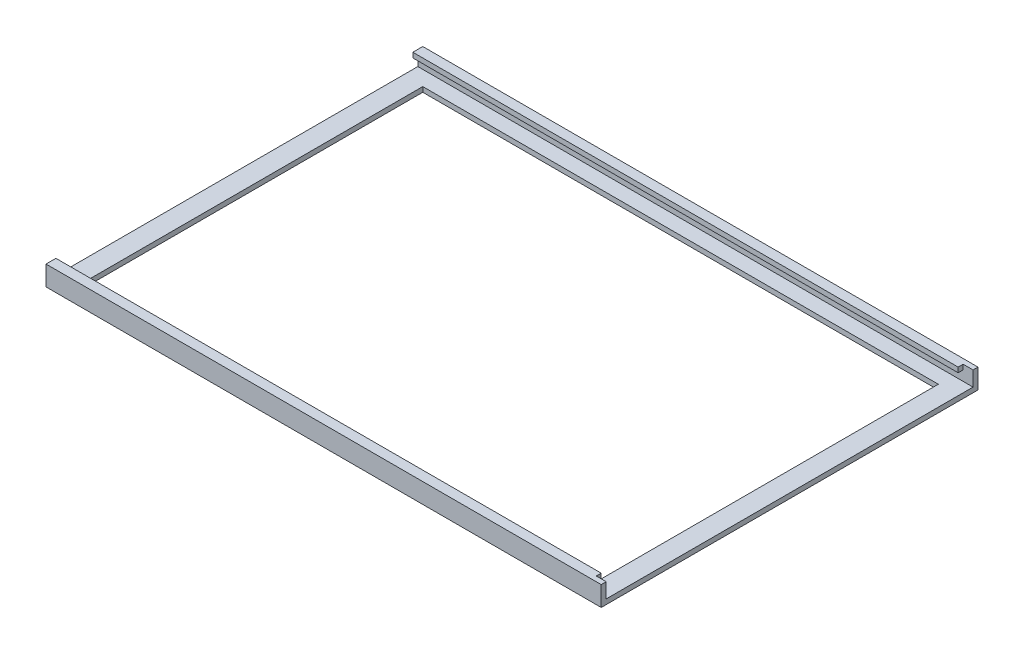
from build123d import *

# Parameters (mm, degrees)
CROQUIS1_W              = 112
CROQUIS1_H              = 76
CROQUIS1_W_2            = 104
CROQUIS1_H_2            = 68
SALIENTE_EXTRUIR3_DEPTH = 1
CROQUIS2_W              = 112
CROQUIS2_H              = 1
SALIENTE_EXTRUIR4_DEPTH = 3
CROQUIS3_W              = 110
CROQUIS3_H              = 1
SALIENTE_EXTRUIR7_DEPTH = 1
CROQUIS5_W              = 110
CROQUIS5_H              = 1
SALIENTE_EXTRUIR8_DEPTH = 1


with BuildPart() as part:
    # Croquis1 → Saliente-Extruir3 (new body)
    with BuildSketch(Plane(origin=(0, 0, 0), x_dir=(1, 0, 0), z_dir=(0, 1, 0))):
        with Locations((56, 38)):
            Rectangle(CROQUIS1_W, CROQUIS1_H)
        with Locations((56, 38)):
            Rectangle(CROQUIS1_W_2, CROQUIS1_H_2, mode=Mode.SUBTRACT)
    extrude(amount=SALIENTE_EXTRUIR3_DEPTH)

    # Croquis2 → Saliente-Extruir4 (add)
    with BuildSketch(Plane(origin=(0, 1, 0), x_dir=(1, 0, 0), z_dir=(0, 1, 0))):
        with Locations((56, 75.5)):
            Rectangle(CROQUIS2_W, CROQUIS2_H)
        with Locations((56, 0.5)):
            Rectangle(CROQUIS2_W, CROQUIS2_H)
    extrude(amount=SALIENTE_EXTRUIR4_DEPTH)

    # Croquis3 → Saliente-Extruir7 (add)
    with BuildSketch(Plane(origin=(0, 0, -1), x_dir=(-1, 0, 0), z_dir=(0, 0, -1))):
        with Locations((-55, 3.5)):
            Rectangle(CROQUIS3_W, CROQUIS3_H)
    extrude(amount=SALIENTE_EXTRUIR7_DEPTH)

    # Croquis5 → Saliente-Extruir8 (add)
    with BuildSketch(Plane.XY.offset(-75)):
        with Locations((55, 3.5)):
            Rectangle(CROQUIS5_W, CROQUIS5_H)
    extrude(amount=SALIENTE_EXTRUIR8_DEPTH)


solid = part.part
